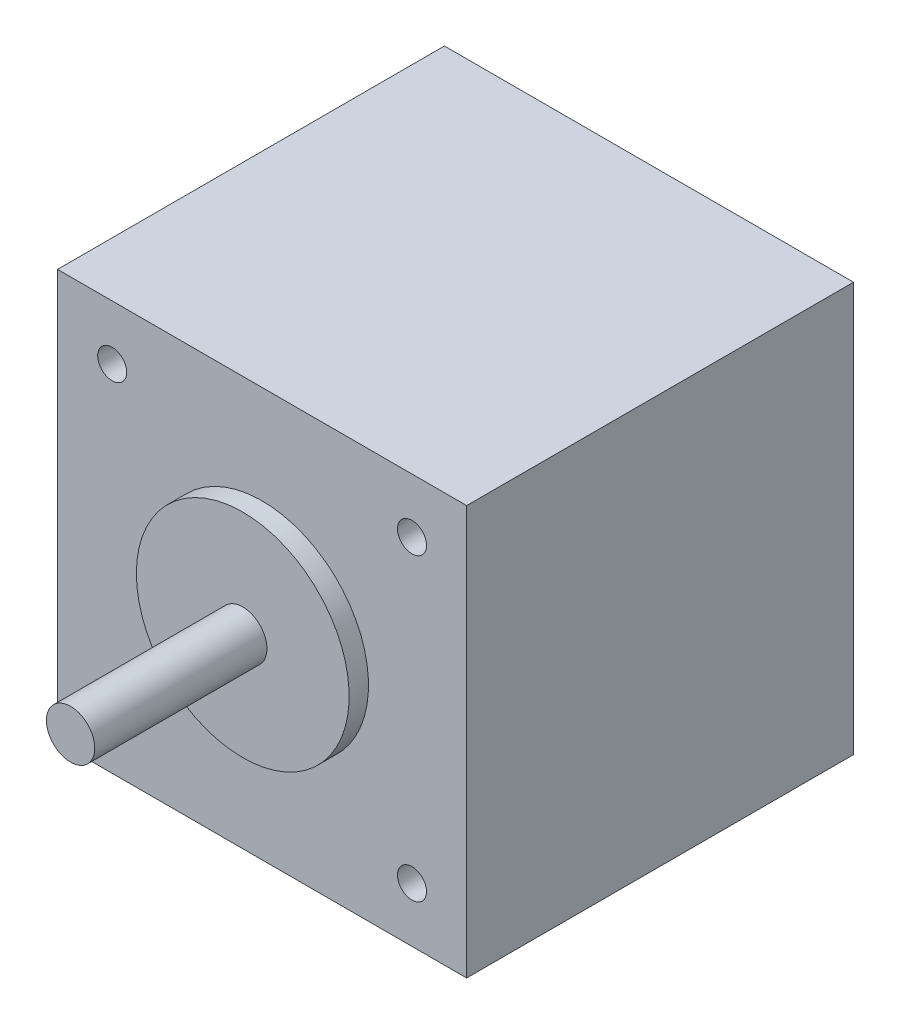
from build123d import *

# Parameters (mm, degrees)
SKETCH_1_W          = 42.3
SKETCH_1_H          = 42.3
EXTRUDE_1533_DEPTH  = 40
SKETCH_2_R          = 2.5
EXTRUDE_1588_DEPTH  = 59.8
SKETCH_3_R          = 11
EXTRUDE_1635_DEPTH  = 42
CUT_EXTRUDE_START   = 40
SKETCH_5_R          = 1.5
CUT_EXTRUDE_3_DEPTH = 4.5


with BuildPart() as part:
    # Эскиз1 → Extrude 1533 (new body)
    with BuildSketch(Plane.XY):
        Rectangle(SKETCH_1_W, SKETCH_1_H)
    extrude(amount=EXTRUDE_1533_DEPTH)

    # Эскиз2 → Extrude 1588 (add)
    with BuildSketch(Plane.XY):
        with Locations(Location((0, 0, 0), (0, 0, 180))):
            Circle(SKETCH_2_R)
    extrude(amount=EXTRUDE_1588_DEPTH)

    # Эскиз3 → Extrude 1635 (add)
    with BuildSketch(Plane.XY):
        with Locations(Location((0, 0, 0), (0, 0, 180))):
            Circle(SKETCH_3_R)
    extrude(amount=EXTRUDE_1635_DEPTH)

    # Эскиз5 → Крепеж_М3_ПРЕДВ (cut)
    with BuildSketch(Plane.XY.offset(CUT_EXTRUDE_START)):
        with Locations((-15.5, -15.5)):
            Circle(SKETCH_5_R)
        with Locations((-15.5, 15.5)):
            Circle(SKETCH_5_R)
        with Locations((15.5, -15.5)):
            Circle(SKETCH_5_R)
        with Locations((15.5, 15.5)):
            Circle(SKETCH_5_R)
    extrude(amount=-CUT_EXTRUDE_3_DEPTH, mode=Mode.SUBTRACT)


solid = part.part
